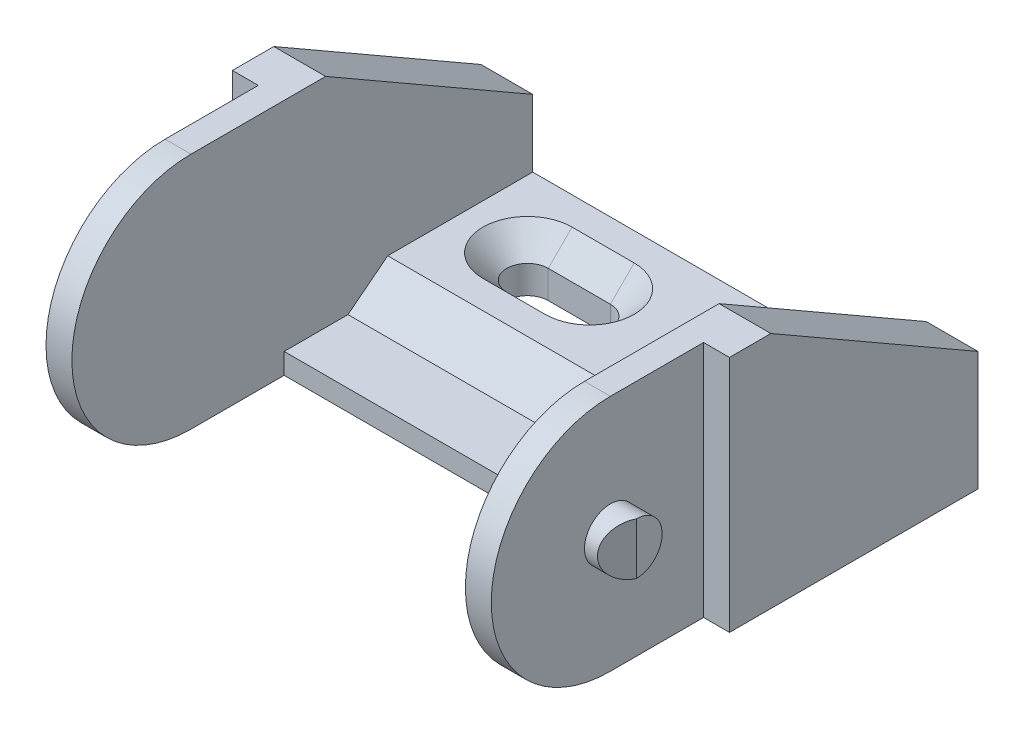
from build123d import *

# Parameters (mm, degrees)
BOSS_EXTRUDE1_DEPTH      = 24
CUT_EXTRUDE1_DEPTH       = 48
CUT_EXTRUDE2_DEPTH       = 19
CUT_EXTRUDE3_DEPTH       = 42.036569057
CHAMFER1_SIZE            = 2.3
SKETCH6_W                = 20.5
SKETCH6_H                = 23
CUT_EXTRUDE4_DEPTH       = 2.5
SKETCH7_R                = 2.5
BOSS_EXTRUDE2_DEPTH      = 2.5
CUT_EXTRUDE5_DEPTH       = 44.462627624
CHAMFER1_OF_MIRROR1_SIZE = 2.3


with BuildPart() as part:
    # Sketch1 → Boss-Extrude1 (new, symmetric)
    with BuildSketch(Plane(origin=(0, 0, 0), x_dir=(0, 0, -1), z_dir=(1, 0, 0))):
        with BuildLine():
            Line((16.5, -11.5), (-16.5, -11.5))
            ThreePointArc((-16.5, -11.5), (-28, 0), (-16.5, 11.5))
            Line((-16.5, 11.5), (16.5, 11.5))
            Line((16.5, 11.5), (16.5, -11.5))
        make_face()
    extrude(amount=BOSS_EXTRUDE1_DEPTH, both=True)

    # Sketch2 → Cut-Extrude1 (cut)
    with BuildSketch(Plane(origin=(24, 0, 0), x_dir=(0, 0, -1), z_dir=(1, 0, 0))):
        Polygon((16.5, 0), (-3.5, 11.5), (16.5, 11.5), align=None)
    extrude(amount=-CUT_EXTRUDE1_DEPTH, mode=Mode.SUBTRACT)

    # Sketch4 → Cut-Extrude2 (cut, symmetric)
    with BuildSketch(Plane(origin=(0, 0, 0), x_dir=(0, 0, -1), z_dir=(1, 0, 0))):
        with BuildLine():
            Line((16.5, -6.5), (16.5, 0))
            Line((16.5, 0), (-3.5, 11.5))
            Line((-3.5, 11.5), (-16.5, 11.5))
            ThreePointArc((-16.5, 11.5), (-28, 0), (-16.5, -11.5))
            Line((-16.5, -11.5), (-7.5, -11.5))
            Line((-7.5, -11.5), (-7.5, -9.5))
            Line((-7.5, -9.5), (-1.339824897, -9.5))
            Line((-1.339824897, -9.5), (2.5, -6.5))
            Line((2.5, -6.5), (16.5, -6.5))
        make_face()
    extrude(amount=CUT_EXTRUDE2_DEPTH, both=True, mode=Mode.SUBTRACT)

    # Sketch5 → Cut-Extrude3 (cut, through all)
    with BuildSketch(Plane(origin=(0, -6.5, 0), x_dir=(1, 0, 0), z_dir=(0, 1, 0))):
        with BuildLine():
            Line((6.5, 11.5), (12.5, 11.5))
            ThreePointArc((12.5, 11.5), (14.5, 9.5), (12.5, 7.5))
            Line((12.5, 7.5), (6.5, 7.5))
            ThreePointArc((6.5, 7.5), (4.5, 9.5), (6.5, 11.5))
        make_face()
    cut_extrude3 = extrude(amount=-CUT_EXTRUDE3_DEPTH, mode=Mode.SUBTRACT)

    # Chamfer1
    chamfer1_edges = [part.edges().sort_by_distance(p)[0] for p in [
        (4.5, -6.5, -9.5),
        (9.5, -6.5, -7.5),
        (14.5, -6.5, -9.5),
        (9.5, -6.5, -11.5),
    ]]
    chamfer(chamfer1_edges, length=CHAMFER1_SIZE)

    # Sketch6 → Cut-Extrude4 (cut)
    with BuildSketch(Plane(origin=(24, 0, 0), x_dir=(0, 0, -1), z_dir=(1, 0, 0))):
        with Locations((-17.75, 0)):
            Rectangle(SKETCH6_W, SKETCH6_H)
    cut_extrude4 = extrude(amount=-CUT_EXTRUDE4_DEPTH, mode=Mode.SUBTRACT)

    # Sketch7 → Boss-Extrude2 (add)
    with BuildSketch(Plane(origin=(21.5, 0, 0), x_dir=(0, 0, -1), z_dir=(1, 0, 0))):
        with Locations(Location((-16.5, 0, 0), (0, 0, 180))):
            Circle(SKETCH7_R)
    boss_extrude2 = extrude(amount=BOSS_EXTRUDE2_DEPTH)

    # Sketch8 → Cut-Extrude5 (cut, through all)
    with BuildSketch(Plane(origin=(0, 11.5, 0), x_dir=(1, 0, 0), z_dir=(0, 1, 0))):
        Polygon((24, -16.5), (22.75, -19), (24, -19), align=None)
    extrude(amount=-CUT_EXTRUDE5_DEPTH, mode=Mode.SUBTRACT)

    # Mirror1: Cut-Extrude3, Cut-Extrude4, Boss-Extrude2 across plane
    add(cut_extrude3.mirror(Plane(origin=(0, 0, 0), x_dir=(0, 0, 1), z_dir=(1, 0, 0))), mode=Mode.SUBTRACT)
    add(cut_extrude4.mirror(Plane(origin=(0, 0, 0), x_dir=(0, 0, 1), z_dir=(1, 0, 0))), mode=Mode.SUBTRACT)
    add(boss_extrude2.mirror(Plane(origin=(0, 0, 0), x_dir=(0, 0, 1), z_dir=(1, 0, 0))))

    # Chamfer1 of Mirror1
    chamfer1_of_mirror1_edges = [part.edges().sort_by_distance(p)[0] for p in [
        (-4.5, -6.5, -9.5),
        (-9.5, -6.5, -7.5),
        (-14.5, -6.5, -9.5),
        (-9.5, -6.5, -11.5),
    ]]
    chamfer(chamfer1_of_mirror1_edges, length=CHAMFER1_OF_MIRROR1_SIZE)


solid = part.part
